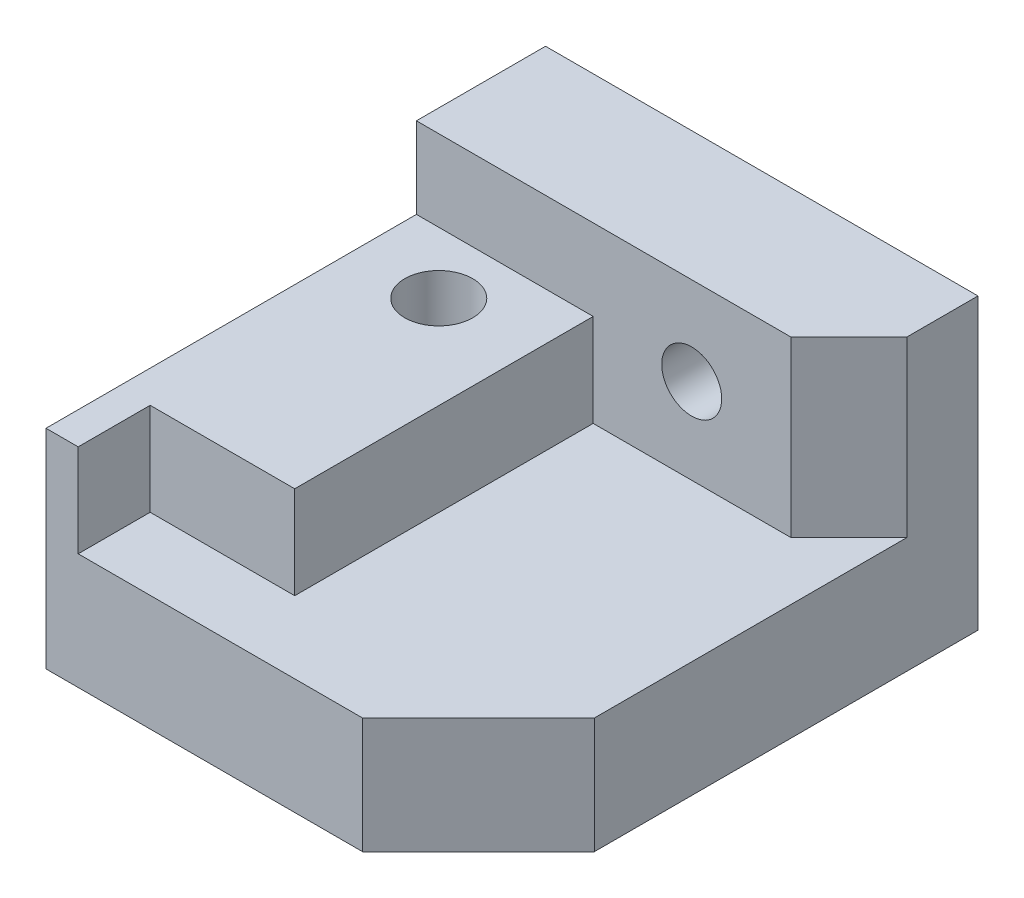
from build123d import *

# Parameters (mm, degrees)
BOSS_EXTRUDE1_DEPTH = 10
BOSS_EXTRUDE2_DEPTH = 8
BOSS_EXTRUDE4_DEPTH = 25
SKETCH3_W           = 12.484022429
SKETCH3_H           = 6.213790253
CUT_EXTRUDE1_DEPTH  = 8
SKETCH7_R           = 2.934045285
CUT_EXTRUDE4_DEPTH  = 18
SKETCH8_R           = 2.590039353
CUT_EXTRUDE5_DEPTH  = 18


with BuildPart() as part:
    # Sketch1 → Boss-Extrude1 (new body)
    with BuildSketch(Plane(origin=(0, 0, 0), x_dir=(1, 0, 0), z_dir=(0, 1, 0))):
        Polygon((27.346217797, 0), (37.346217797, 10), (37.346217797, 43.13883642), (0, 43.13883642), (0, 0), align=None)
    extrude(amount=BOSS_EXTRUDE1_DEPTH)

    # 3DSketch1 → Boss-Extrude2 (add)
    with BuildSketch(Plane(origin=(0, 10, -32.014495021), x_dir=(0.4303839412255019, 0, 0.9026459234579215), z_dir=(0, 1, 0))):
        Polygon((0, 0), (6.569636602, 13.778524544), (35.467390024, 0), (28.897753422, -13.778524544), align=None)
    extrude(amount=BOSS_EXTRUDE2_DEPTH)

    # Sketch2 → Boss-Extrude4 (add)
    with BuildSketch(Plane(origin=(0, 0, 0), x_dir=(1, 0, 0), z_dir=(0, 1, 0))):
        Polygon((0, 43.13883642), (37.346217797, 43.13883642), (37.346217797, 36.988423425), (32.346217797, 31.988423425), (0, 31.988423425), align=None)
    extrude(amount=BOSS_EXTRUDE4_DEPTH)

    # Sketch3 → Cut-Extrude1 (cut)
    with BuildSketch(Plane(origin=(0, 18, 0), x_dir=(1, 0, 0), z_dir=(0, 1, 0))):
        with Locations((9.02258389, 3.106895126)):
            Rectangle(SKETCH3_W, SKETCH3_H)
    extrude(amount=-CUT_EXTRUDE1_DEPTH, mode=Mode.SUBTRACT)

    # Sketch7 → Cut-Extrude4 (cut)
    with BuildSketch(Plane(origin=(0, 18, 0), x_dir=(1, 0, 0), z_dir=(0, 1, 0))):
        with Locations(Location((7.23477268, 26.681503573, 0), (0, 0, 270))):
            Circle(SKETCH7_R)
    extrude(amount=-CUT_EXTRUDE4_DEPTH, mode=Mode.SUBTRACT)

    # Sketch8 → Cut-Extrude5 (cut)
    with BuildSketch(Plane.XY.offset(-31.988423425)):
        with Locations((23.773325806, 17.384751646)):
            Circle(SKETCH8_R)
    extrude(amount=-CUT_EXTRUDE5_DEPTH, mode=Mode.SUBTRACT)


solid = part.part
